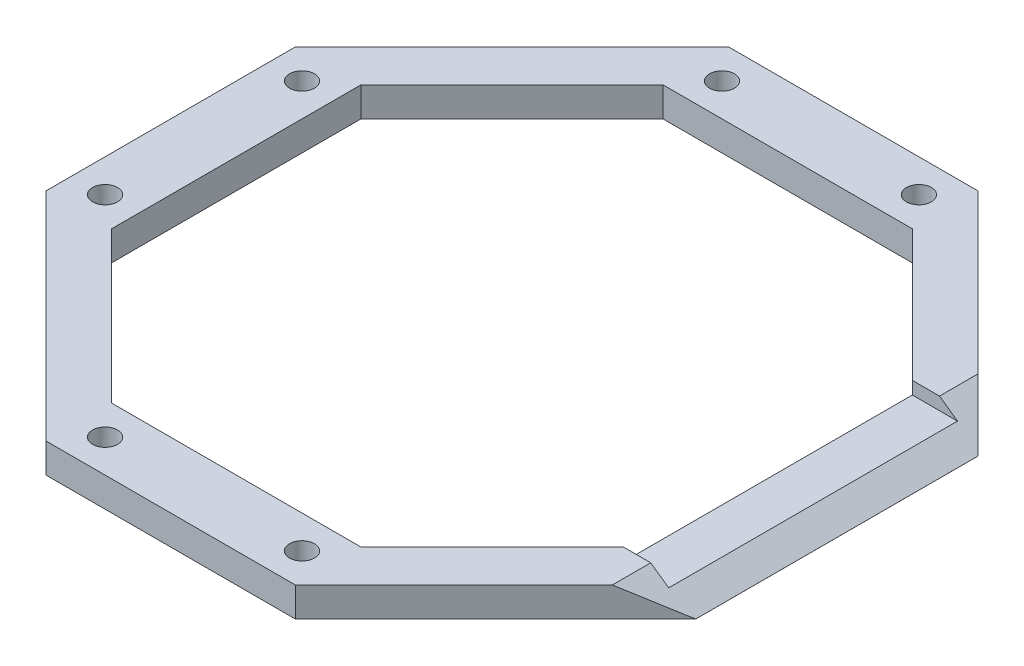
from build123d import *

# Parameters (mm, degrees)
BOSS_EXTRUDE3_DEPTH             = 4.5
CUT_EXTRUDE4_DEPTH              = 96.5
CUT_EXTRUDE5_DEPTH              = 32.5
F_4_0MM_PRESS_DOWEL_HOLE3_D     = 3.8
F_4_0MM_PRESS_DOWEL_HOLE3_DEPTH = 57
F_4_0MM_PRESS_DOWEL_HOLE3_TIP   = 4.587005769


with BuildPart() as part:
    # Sketch9 → Boss-Extrude3 (new body)
    with BuildSketch(Plane(origin=(0, 0, 0), x_dir=(1, 0, 0), z_dir=(0, 1, 0))):
        Polygon((19.003020228, -51.996979772), (-18.996979772, -51.996979772), (-51.996979772, -18.996979772), (-51.996979772, 18.996979772), (-18.996979772, 51.996979772), (19.003020228, 51.996979772), (49.493959544, 21.5), (49.493959544, -21.5), align=None)
        Polygon((-41.996979772, -18.996979772), (-41.996979772, 18.996979772), (-18.996979772, 41.996979772), (18.996979772, 41.996979772), (38.993959544, 22), (38.993959544, -22), (18.996979772, -41.996979772), (-18.996979772, -41.996979772), align=None, mode=Mode.SUBTRACT)
    extrude(amount=BOSS_EXTRUDE3_DEPTH)

    # Sketch13 → Cut-Extrude4 (cut)
    with BuildSketch(Plane.XY.offset(51.996979772)):
        Polygon((64.276727826, 15.051195438), (49.5, 0), (43.14121867, 4.5), (43.14121867, 18.660375199), align=None)
    extrude(amount=-CUT_EXTRUDE4_DEPTH, mode=Mode.SUBTRACT)

    # Sketch14 → Cut-Extrude5 (cut)
    with BuildSketch(Plane.ZY.offset(-38.993959544)):
        Polygon((-22, 4.5), (-22, 2.563194296), (22, 2.563194296), (22, 4.5), (18.996979772, 4.5), (-18.996979772, 4.5), align=None)
    extrude(amount=-CUT_EXTRUDE5_DEPTH, mode=Mode.SUBTRACT)

    # Ø4.0mm Press Dowel Hole3
    with Locations(Plane(origin=(0, 4.5, 0), x_dir=(1, 0, 0), z_dir=(0, 1, 0))):
        with Locations((-46.996979772, -15), (-15, 46.996979772), (-46.996979772, 15), (15, 46.996979772), (15, -46.996979772), (-15, -46.996979772)):
            Hole(F_4_0MM_PRESS_DOWEL_HOLE3_D / 2, depth=F_4_0MM_PRESS_DOWEL_HOLE3_DEPTH)
            with Locations((0, 0, -(F_4_0MM_PRESS_DOWEL_HOLE3_DEPTH + F_4_0MM_PRESS_DOWEL_HOLE3_TIP / 2))):  # 45° drill point
                Cone(0, F_4_0MM_PRESS_DOWEL_HOLE3_D / 2, F_4_0MM_PRESS_DOWEL_HOLE3_TIP, mode=Mode.SUBTRACT)


solid = part.part
